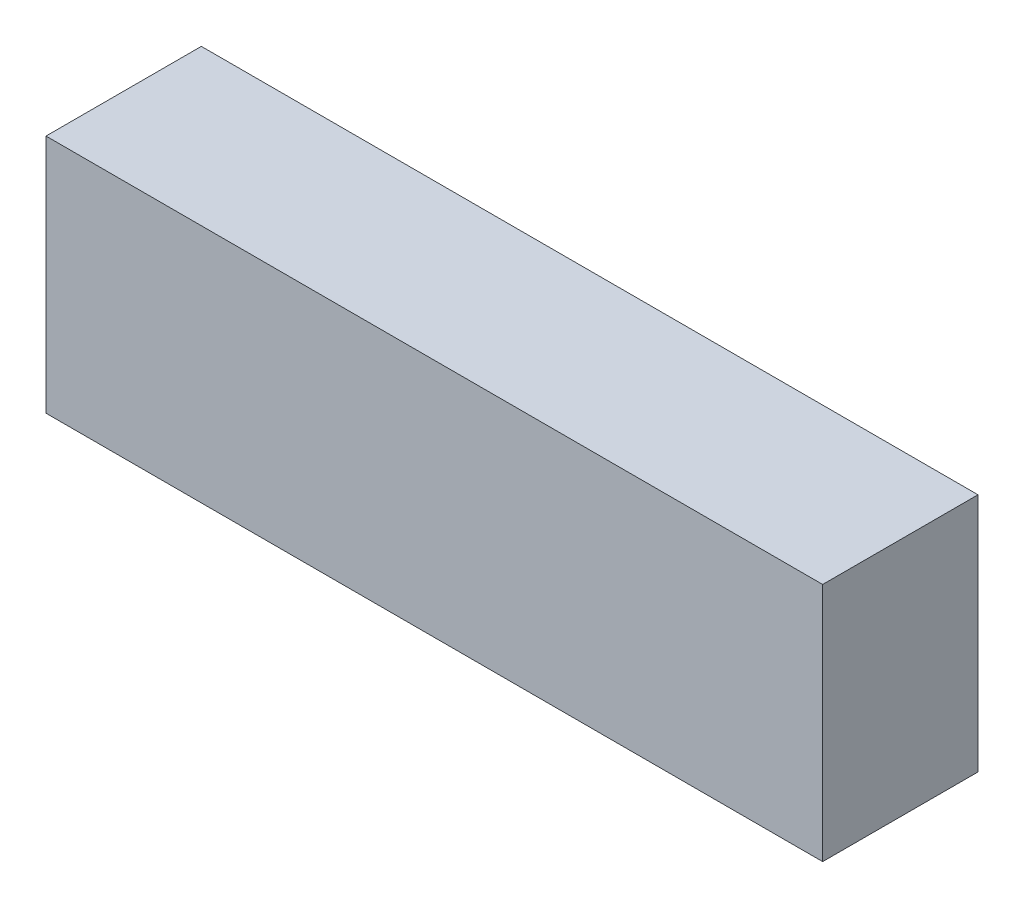
from build123d import *

# Parameters (mm, degrees)
SKETCH1_W           = 110
SKETCH1_H           = 34
BOSS_EXTRUDE1_DEPTH = 22


with BuildPart() as part:
    # Sketch1 → Boss-Extrude1 (new body)
    with BuildSketch(Plane.XY):
        Rectangle(SKETCH1_W, SKETCH1_H)
    extrude(amount=BOSS_EXTRUDE1_DEPTH)


solid = part.part
